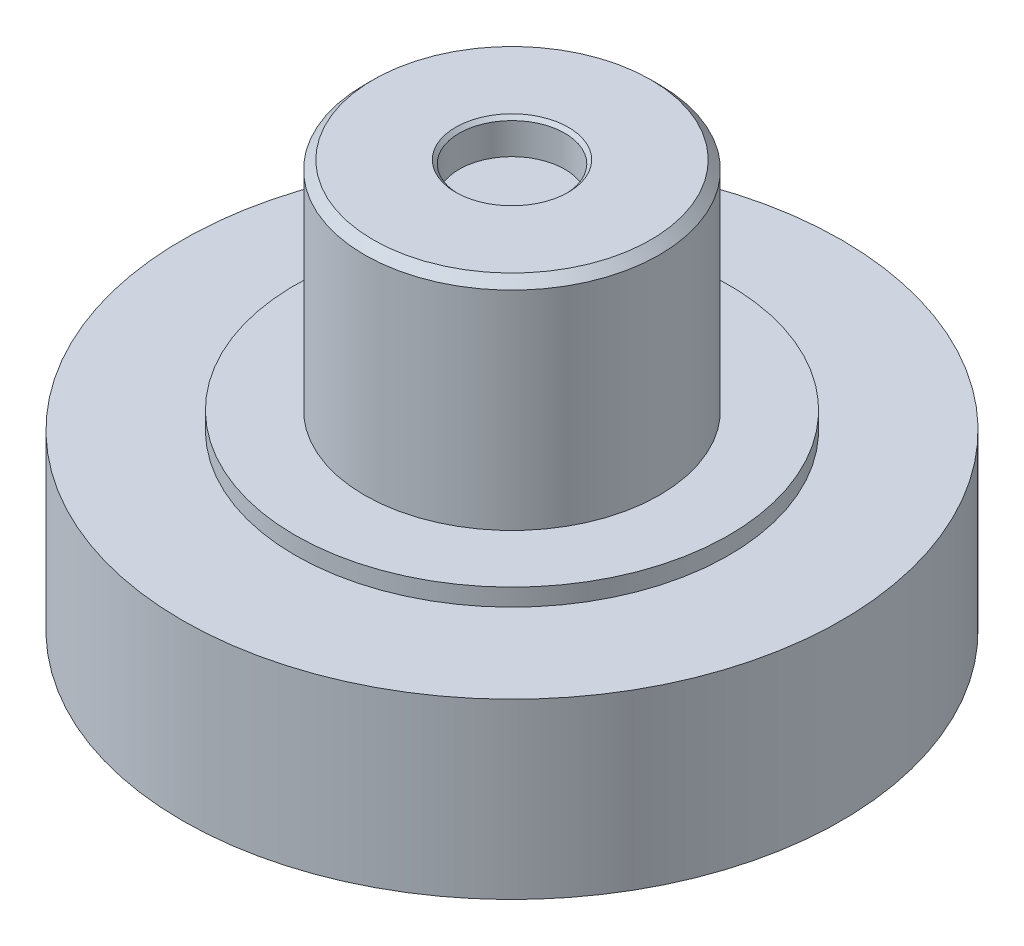
from build123d import *

# Parameters (mm, degrees)
SKETCH_1_R          = 19
EXTRUDE_1_DEPTH     = 10
SKETCH_2_R          = 12.5
EXTRUDE_2_DEPTH     = 1
SKETCH_3_R          = 8.5
EXTRUDE_3_DEPTH     = 12.5
SKETCH_4_R          = 3.05
CUT_EXTRUDE_4_DEPTH = 2
SKETCH_7_R          = 5.25
CUT_EXTRUDE_3_DEPTH = 0.5
CUT_EXTRUDE_3_DRAFT = -45
FILLET_3_R          = 0.8
CHAMFER_1_SIZE      = 0.5
CHAMFER_2_SIZE      = 0.2


with BuildPart() as part:
    # Эскиз1 → Бобышка-Вытянуть1 (new body)
    with BuildSketch(Plane(origin=(0, 0, 0), x_dir=(1, 0, 0), z_dir=(0, 1, 0))):
        with Locations(Location((0, 0, 0), (0, 0, 270))):
            Circle(SKETCH_1_R)
    extrude(amount=EXTRUDE_1_DEPTH)

    # Эскиз2 → Бобышка-Вытянуть2 (add)
    with BuildSketch(Plane(origin=(0, 10, 0), x_dir=(1, 0, 0), z_dir=(0, 1, 0))):
        with Locations(Location((0, 0, 0), (0, 0, 270))):
            Circle(SKETCH_2_R)
    extrude(amount=EXTRUDE_2_DEPTH)

    # Эскиз3 → Бобышка-Вытянуть3 (add)
    with BuildSketch(Plane(origin=(0, 11, 0), x_dir=(1, 0, 0), z_dir=(0, 1, 0))):
        with Locations(Location((0, 0, 0), (0, 0, 270))):
            Circle(SKETCH_3_R)
    extrude(amount=EXTRUDE_3_DEPTH)

    # Эскиз4 → Вырез-Вытянуть4 (cut)
    with BuildSketch(Plane(origin=(0, 23.5, 0), x_dir=(1, 0, 0), z_dir=(0, 1, 0))):
        with Locations(Location((0, 0, 0), (0, 0, 270))):
            Circle(SKETCH_4_R)
    extrude(amount=-CUT_EXTRUDE_4_DEPTH, mode=Mode.SUBTRACT)


with BuildPart() as cut_extrude_3_tool:
    # Эскиз7 → Вырез-Вытянуть3 (with draft: the straight prism first)
    with BuildSketch(Plane.XZ):
        with Locations((0, 11.5)):
            Circle(SKETCH_7_R)
    extrude(amount=-CUT_EXTRUDE_3_DEPTH)
    # Вырез-Вытянуть3: the draft: its side faces are tilted about the plane it starts from
    cut_extrude_3_sides = [cut_extrude_3_tool.faces().sort_by_distance(p)[0] for p in [
        (-5.25, 0.25, 11.5),
    ]]
    draft(cut_extrude_3_sides, Plane.XZ, CUT_EXTRUDE_3_DRAFT)


with BuildPart() as part_1:
    add(part.part)

    # Вырез-Вытянуть3: cut by cut_extrude_3_tool
    add(cut_extrude_3_tool.part, mode=Mode.SUBTRACT)

    # Скругление3
    fillet_3_edges = [part_1.edges().sort_by_distance(p)[0] for p in [
        (-4.75, 0.5, 11.5),
        (-5.25, 0, 11.5),
    ]]
    fillet(fillet_3_edges, radius=FILLET_3_R)

    # Фаска1
    chamfer_1_edges = [part_1.edges().sort_by_distance(p)[0] for p in [
        (0, 23.5, -8.5),
    ]]
    chamfer(chamfer_1_edges, length=CHAMFER_1_SIZE)

    # Фаска2
    chamfer_2_edges = [part_1.edges().sort_by_distance(p)[0] for p in [
        (0, 23.5, -3.05),
    ]]
    chamfer(chamfer_2_edges, length=CHAMFER_2_SIZE)


solid = part_1.part
